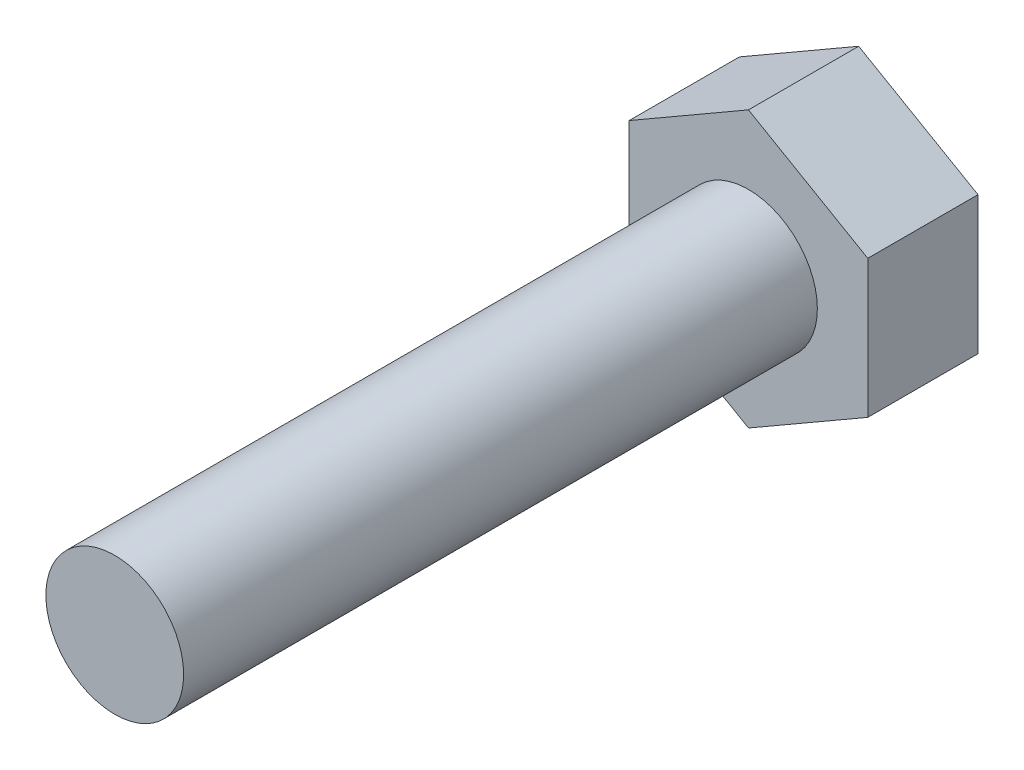
from build123d import *

# Parameters (mm, degrees)
ESQUISSE1_R        = 1.25
BOSS_EXTRU_1_DEPTH = 11.5
BOSS_EXTRU_2_DEPTH = 2


with BuildPart() as part:
    # Esquisse1 → Boss.-Extru.1 (new body)
    with BuildSketch(Plane.XY):
        Circle(ESQUISSE1_R)
    extrude(amount=BOSS_EXTRU_1_DEPTH)

    # Esquisse2 → Boss.-Extru.2 (add)
    with BuildSketch(Plane(origin=(0, 0, 0), x_dir=(-1, 0, 0), z_dir=(0, 0, -1))):
        Polygon((0, 2.5), (-2.165063509, 1.25), (-2.165063509, -1.25), (0, -2.5), (2.165063509, -1.25), (2.165063509, 1.25), align=None)
    extrude(amount=BOSS_EXTRU_2_DEPTH)


solid = part.part
